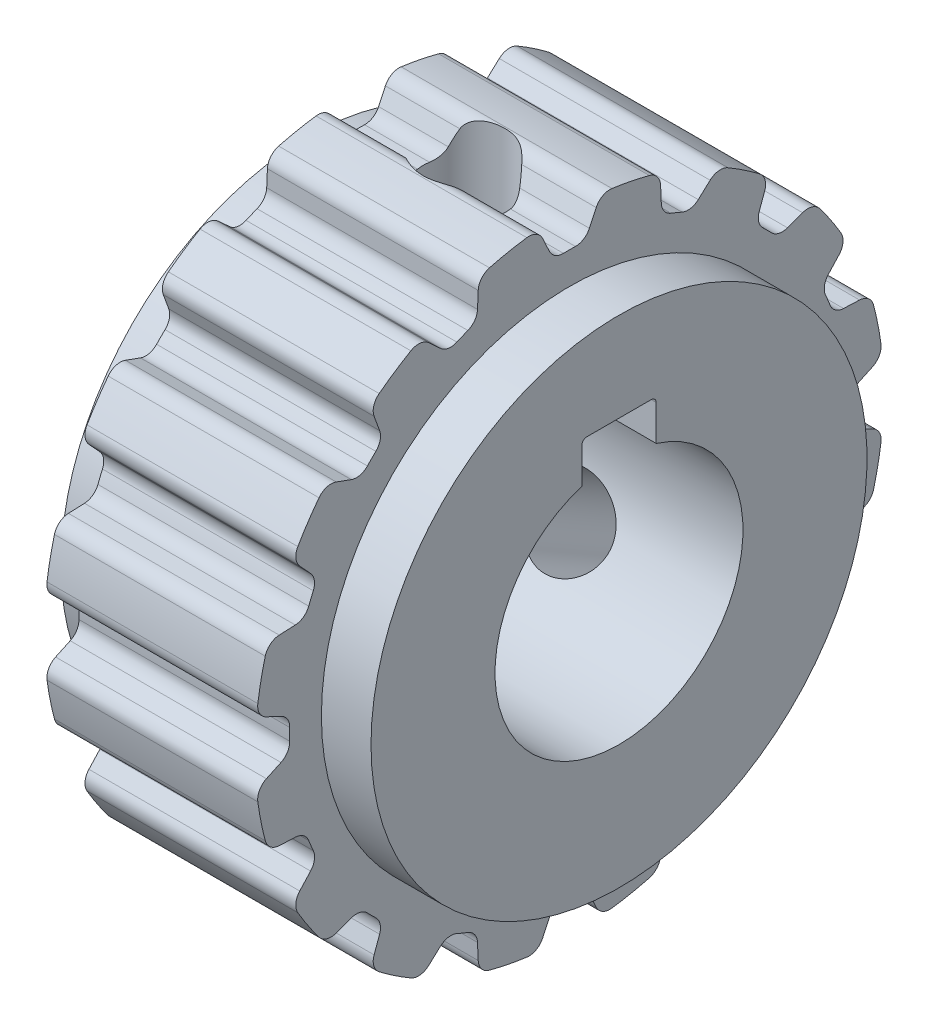
from build123d import *

# Parameters (mm, degrees)
CUT_EXTRUDE1_DEPTH  = 21.780153994
CIRPATTERN1_COUNT   = 16
TAPPED_HOLE1_REACH  = 32.85
TAPPED_HOLE1_BORE_R = 1.65
CIRPATTERN2_COUNT   = 2
CIRPATTERN2_ANGLE   = 120
CUT_EXTRUDE2_DEPTH  = 22.730403029


with BuildPart() as part:
    # Sketch1 → Revolve1 (revolve)
    with BuildSketch(Plane.XY, mode=Mode.PRIVATE) as revolve1_sk:
        Polygon((0, 5), (12.5, 5), (12.5, 10), (10.5, 10), (10.5, 12.68), (2, 12.68), (2, 10), (0, 10), align=None)
    revolve(revolve1_sk.sketch.rotate(Axis((0, 0, 0), (1, 0, 0)), 90), axis=Axis((0, 0, 0), (1, 0, 0)))

    # Sketch2 → Cut-Extrude1 (cut, through all)
    with BuildSketch(Plane.ZY.offset(-2)):
        with BuildLine():
            Line((-0.806316069, 11.629500863), (-1.080185063, 12.216814818))
            ThreePointArc((-1.080185063, 12.216814818), (-1.340917612, 12.494525576), (-1.715563884, 12.563408795))
            ThreePointArc((-1.715563884, 12.563408795), (0, 12.68), (1.715563884, 12.563408795))
            ThreePointArc((1.715563884, 12.563408795), (1.340917612, 12.494525576), (1.080185063, 12.216814818))
            Line((1.080185063, 12.216814818), (0.806316069, 11.629500863))
            ThreePointArc((0.806316069, 11.629500863), (0.575718483, 11.369364772), (0.240464477, 11.277436625))
            ThreePointArc((0.240464477, 11.277436625), (0, 11.28), (-0.240464477, 11.277436625))
            ThreePointArc((-0.240464477, 11.277436625), (-0.575718483, 11.369364772), (-0.806316069, 11.629500863))
        make_face()
    cut_extrude1 = extrude(amount=-CUT_EXTRUDE1_DEPTH, mode=Mode.SUBTRACT)

    # CirPattern1: Cut-Extrude1 ×16 about axis
    cirpattern1_axis = Axis((0, 0, 0), (1, 0, 0))
    for i in range(1, CIRPATTERN1_COUNT):
        add(cut_extrude1.rotate(cirpattern1_axis, i * 360 / CIRPATTERN1_COUNT), mode=Mode.SUBTRACT)

    # Tapped Hole1 bore → Tapped Hole1 (cut, up to next)
    with BuildSketch(Plane(origin=(0, 12.68, 0), x_dir=(1, 0, 0), z_dir=(0, 1, 0)), mode=Mode.PRIVATE) as tapped_hole1_sk1:
        with Locations((6.25, 0)):
            Circle(TAPPED_HOLE1_BORE_R)
    tapped_hole1_tool1 = extrude(tapped_hole1_sk1.sketch, amount=-TAPPED_HOLE1_REACH, mode=Mode.PRIVATE) & part.part
    tapped_hole1 = tapped_hole1_tool1.solids().sort_by_distance((6.25, 12.68, 0))[0]
    add(tapped_hole1, mode=Mode.SUBTRACT)

    # CirPattern2: Tapped Hole1; each copy of Tapped Hole1 runs up to whatever stops it at its own place
    cirpattern2_before = part.part  # the part as the pattern finds it: every copy runs up to it
    cirpattern2_tapped_hole1_long = extrude(tapped_hole1_sk1.sketch, amount=-TAPPED_HOLE1_REACH, mode=Mode.PRIVATE)
    cirpattern2_tapped_hole1_tool1 = cirpattern2_tapped_hole1_long.rotate(Axis((0, 0, 0), (-1, 0, 0)), 1 * CIRPATTERN2_ANGLE / (CIRPATTERN2_COUNT - 1)) & cirpattern2_before
    add(cirpattern2_tapped_hole1_tool1.solids().sort_by_distance((6.25, -6.34, -10.981202))[0], mode=Mode.SUBTRACT)

    # Sketch5 → Cut-Extrude2 (cut, through all)
    with BuildSketch(Plane(origin=(0, 0, 0), x_dir=(0, 0, -1), z_dir=(1, 0, 0))):
        with BuildLine():
            Line((-1.5, 0), (1.5, 0))
            Line((1.5, 0), (1.5, 6.2))
            ThreePointArc((1.5, 6.2), (1.441421356, 6.341421356), (1.3, 6.4))
            Line((1.3, 6.4), (-1.3, 6.4))
            ThreePointArc((-1.3, 6.4), (-1.441421356, 6.341421356), (-1.5, 6.2))
            Line((-1.5, 6.2), (-1.5, 0))
        make_face()
    extrude(amount=CUT_EXTRUDE2_DEPTH, mode=Mode.SUBTRACT)


solid = part.part
